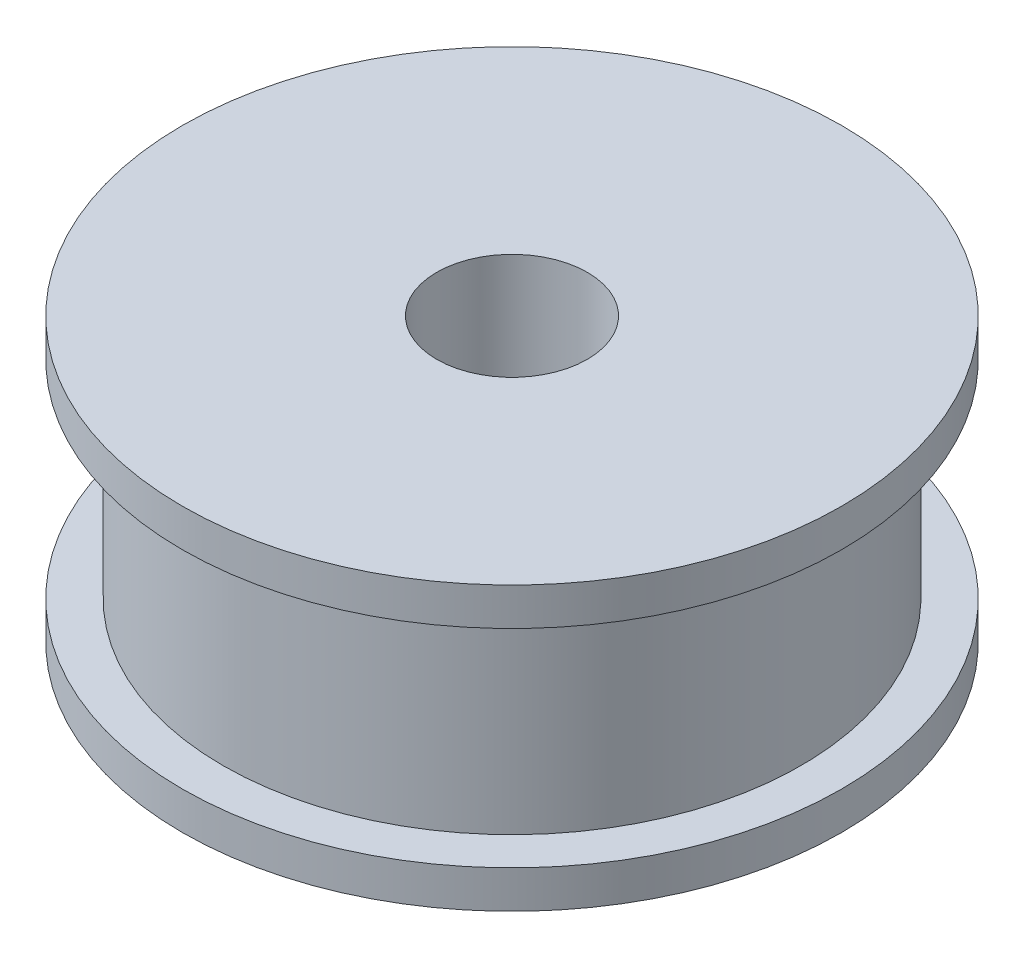
from build123d import *

# Parameters (mm, degrees)
SKETCH_1_R      = 15.345
SKETCH_1_R_2    = 4
EXTRUDE_1_DEPTH = 11
SKETCH_2_R      = 17.5
SKETCH_2_R_2    = 4
EXTRUDE_2_DEPTH = 2
EXTRUDE_START   = 2
SKETCH_3_R      = 17.5
SKETCH_3_R_2    = 4
EXTRUDE_3_DEPTH = 2


with BuildPart() as part:
    # 草图1 → 凸台-拉伸1 (new body)
    with BuildSketch(Plane(origin=(0, 0, 0), x_dir=(1, 0, 0), z_dir=(0, 1, 0))):
        with Locations(Location((0, 0, 0), (0, 0, 270))):
            Circle(SKETCH_1_R)
        with Locations(Location((0, 0, 0), (0, 0, 270))):
            Circle(SKETCH_1_R_2, mode=Mode.SUBTRACT)
    extrude(amount=EXTRUDE_1_DEPTH)

    # 草图2 → 凸台-拉伸2 (add)
    with BuildSketch(Plane(origin=(0, 11, 0), x_dir=(1, 0, 0), z_dir=(0, 1, 0))):
        with Locations(Location((0, 0, 0), (0, 0, 270))):
            Circle(SKETCH_2_R)
        with Locations(Location((0, 0, 0), (0, 0, 270))):
            Circle(SKETCH_2_R_2, mode=Mode.SUBTRACT)
    extrude(amount=EXTRUDE_2_DEPTH)

    # 草图3 → 凸台-拉伸3 (add)
    with BuildSketch(Plane.XZ.offset(EXTRUDE_START)):
        with Locations(Location((0, 0, 0), (0, 0, 90))):
            Circle(SKETCH_3_R)
        with Locations(Location((0, 0, 0), (0, 0, 270))):
            Circle(SKETCH_3_R_2, mode=Mode.SUBTRACT)
    extrude(amount=-EXTRUDE_3_DEPTH)


solid = part.part
